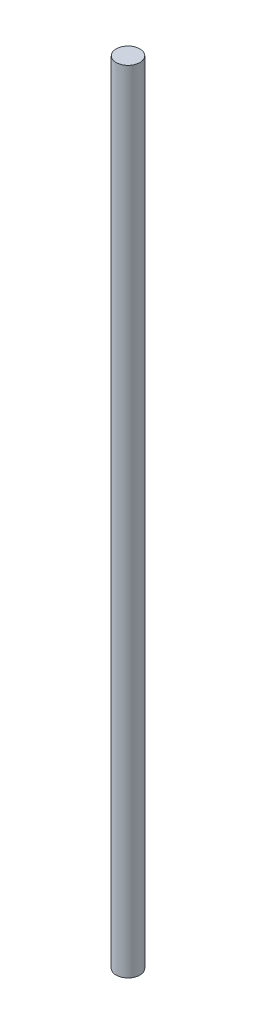
from build123d import *

# Parameters (mm, degrees)
SKETCH_1_R      = 1.5
EXTRUDE_1_DEPTH = 100


with BuildPart() as part:
    # 草图1 → 凸台-拉伸1 (new body)
    with BuildSketch(Plane(origin=(0, 0, 0), x_dir=(1, 0, 0), z_dir=(0, 1, 0))):
        with Locations(Location((0, 0, 0), (0, 0, 270))):
            Circle(SKETCH_1_R)
    extrude(amount=EXTRUDE_1_DEPTH)


solid = part.part
